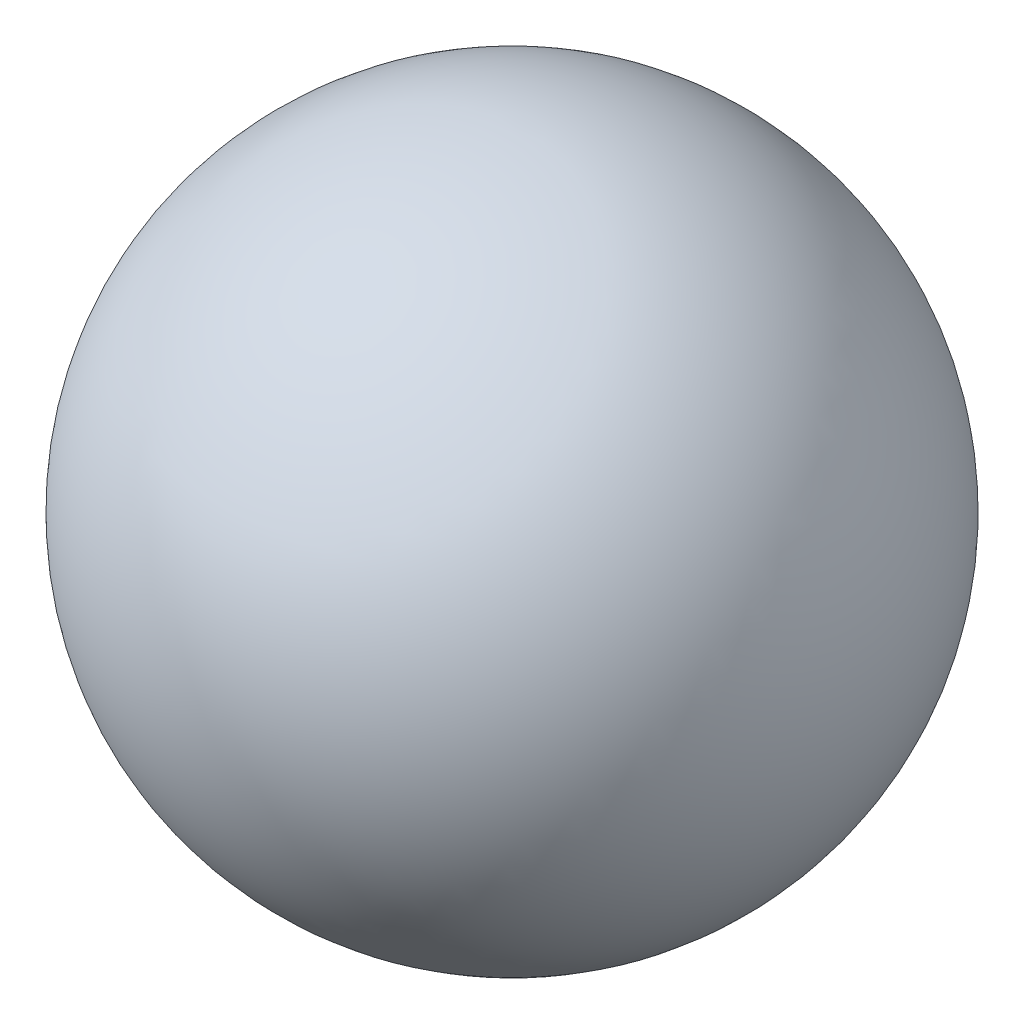
from build123d import *

# Parameters (mm, degrees)
CUT_EXTRUDE1_DEPTH      = 35.641016151
CUT_EXTRUDE1_DEPTH_BACK = 35.641016151
M10_TAPPED_HOLE1_D      = 8.5
M10_TAPPED_HOLE1_DEPTH  = 10
M10_TAPPED_HOLE1_TIP    = 2.553657631


with BuildPart() as part:
    # Sketch2 → Revolve1 (revolve)
    with BuildSketch(Plane.XY):
        with BuildLine():
            Line((0, 20), (0, -20))
            ThreePointArc((0, -20), (20, 0), (0, 20))
        make_face()
    revolve(axis=Axis((0, 20, 0), (0, -1, 0)))

    # Sketch3 → Cut-Extrude1 (cut, two sides: drawn at the far end of the back side and taken through both)
    with BuildSketch(Plane.XY.offset(-CUT_EXTRUDE1_DEPTH_BACK)):
        Polygon((-113.979792733, -18), (-8.717797887, -18), (8.717797887, -18), (113.979792733, -18), (113.979792733, -228.523989691), (-113.979792733, -228.523989691), align=None)
    extrude(amount=CUT_EXTRUDE1_DEPTH + CUT_EXTRUDE1_DEPTH_BACK, mode=Mode.SUBTRACT)

    # M10 Tapped Hole1
    with Locations(Plane(origin=(0, -18, 0), x_dir=(-1, 0, 0), z_dir=(0, -1, 0))):
        with Locations((0, 0)):
            Hole(M10_TAPPED_HOLE1_D / 2, depth=M10_TAPPED_HOLE1_DEPTH)
            with Locations((0, 0, -(M10_TAPPED_HOLE1_DEPTH + M10_TAPPED_HOLE1_TIP / 2))):  # 118° drill point
                Cone(0, M10_TAPPED_HOLE1_D / 2, M10_TAPPED_HOLE1_TIP, mode=Mode.SUBTRACT)


solid = part.part
